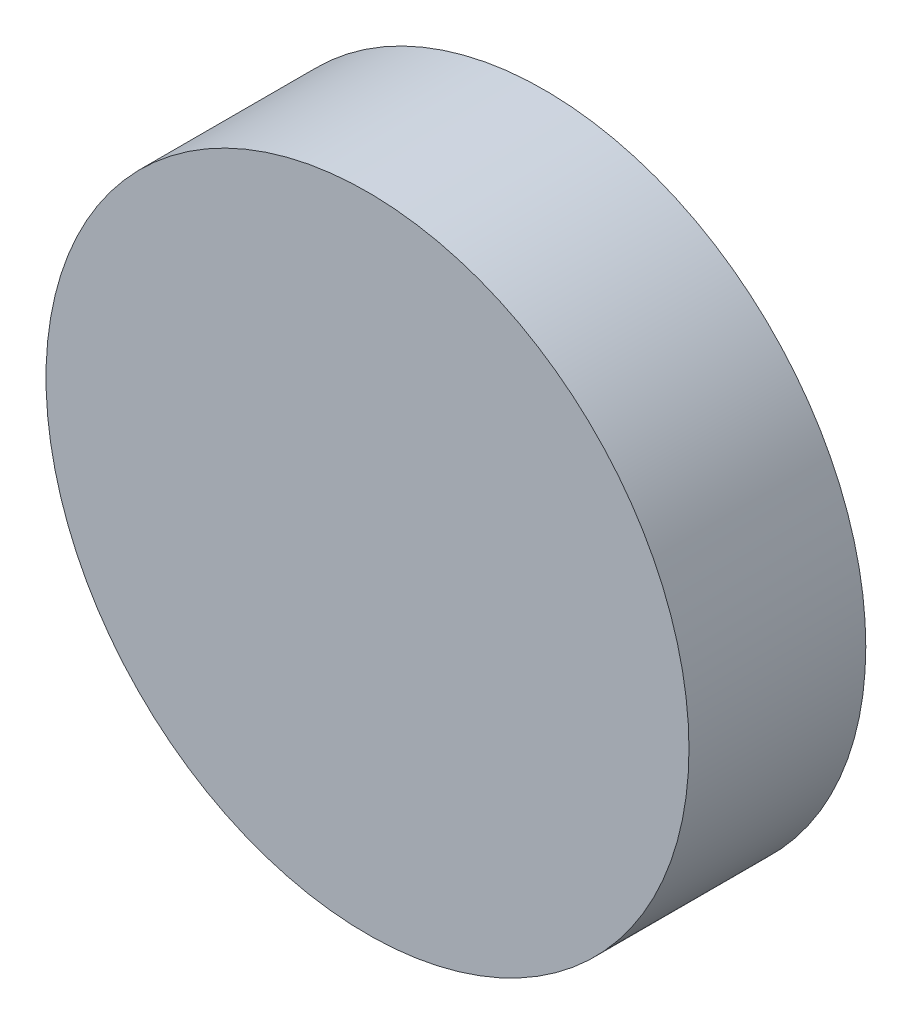
from build123d import *

# Parameters (mm, degrees)
SKETCH1_R           = 20
BOSS_EXTRUDE1_DEPTH = 11


with BuildPart() as part:
    # Sketch1 → Boss-Extrude1 (new body)
    with BuildSketch(Plane.XY):
        Circle(SKETCH1_R)
    extrude(amount=BOSS_EXTRUDE1_DEPTH)


solid = part.part
